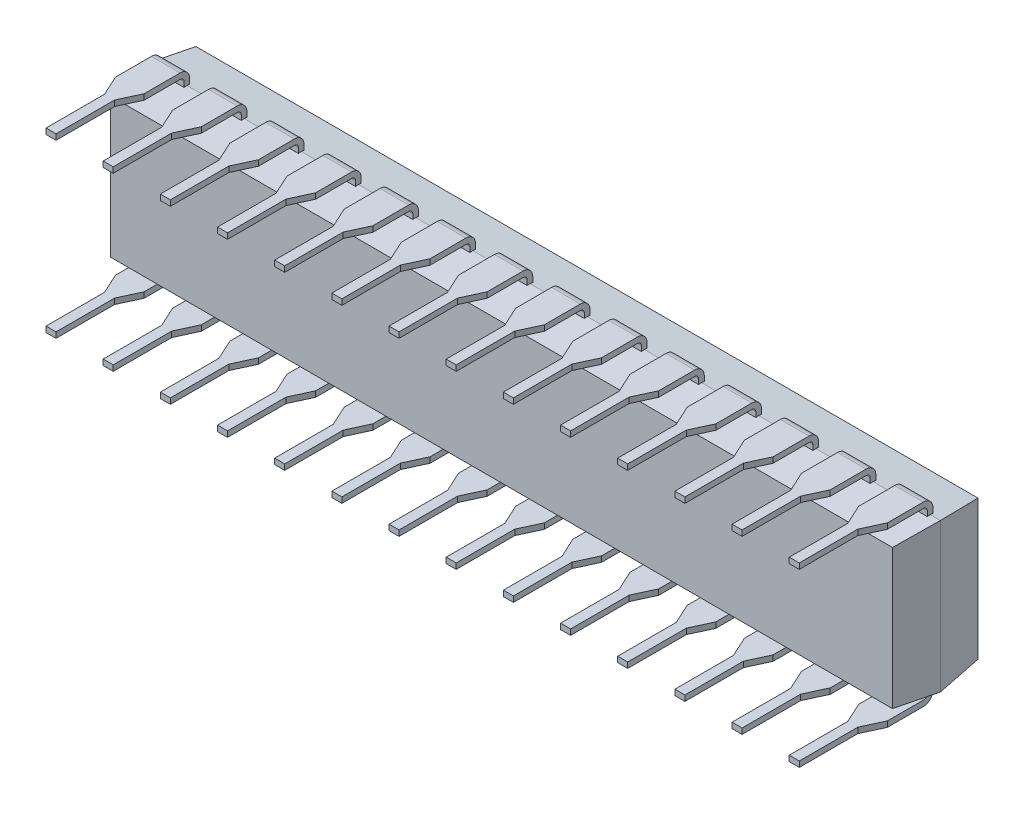
from build123d import *

# Parameters (mm, degrees)
RESSALTO_EXTRUS_O1_DEPTH        = 17.6
CORTE_EXTRUS_O2_DEPTH           = 3.55
ESBO_O8_R                       = 1
CORTE_EXTRUS_O5_DEPTH           = 0.5
ESBO_O6_W                       = 1.275
ESBO_O6_H                       = 0.25
RESSALTO_EXTRUS_O2_DEPTH        = 0.025
ESBO_O7_W                       = 1.275
ESBO_O7_H                       = 0.25
CORTE_EXTRUS_O6_START           = -0.25
CORTE_EXTRUS_O6_DEPTH           = 0.25
ESBO_O10_W                      = 0.445
ESBO_O10_H                      = 0.25
RESSALTO_EXTRUS_O3_DEPTH        = 2.6
PADR_O_LINEAR1_COUNT            = 14
PADR_O_LINEAR1_PITCH            = 2.54
PADR_O_LINEAR1_COPY_1_SKETCH_W  = 1.275
PADR_O_LINEAR1_COPY_1_SKETCH_H  = 0.25
PADR_O_LINEAR1_COPY_1_DEPTH     = 0.025
PADR_O_LINEAR1_COPY_2_SKETCH_W  = 1.275
PADR_O_LINEAR1_COPY_2_SKETCH_H  = 0.25
PADR_O_LINEAR1_COPY_2_DEPTH     = 0.025
PADR_O_LINEAR1_COPY_3_SKETCH_W  = 1.275
PADR_O_LINEAR1_COPY_3_SKETCH_H  = 0.25
PADR_O_LINEAR1_COPY_3_DEPTH     = 0.025
PADR_O_LINEAR1_COPY_4_SKETCH_W  = 1.275
PADR_O_LINEAR1_COPY_4_SKETCH_H  = 0.25
PADR_O_LINEAR1_COPY_4_DEPTH     = 0.025
PADR_O_LINEAR1_COPY_5_SKETCH_W  = 1.275
PADR_O_LINEAR1_COPY_5_SKETCH_H  = 0.25
PADR_O_LINEAR1_COPY_5_DEPTH     = 0.025
PADR_O_LINEAR1_COPY_6_SKETCH_W  = 1.275
PADR_O_LINEAR1_COPY_6_SKETCH_H  = 0.25
PADR_O_LINEAR1_COPY_6_DEPTH     = 0.025
PADR_O_LINEAR1_COPY_7_SKETCH_W  = 1.275
PADR_O_LINEAR1_COPY_7_SKETCH_H  = 0.25
PADR_O_LINEAR1_COPY_7_DEPTH     = 0.025
PADR_O_LINEAR1_COPY_8_SKETCH_W  = 1.275
PADR_O_LINEAR1_COPY_8_SKETCH_H  = 0.25
PADR_O_LINEAR1_COPY_8_DEPTH     = 0.025
PADR_O_LINEAR1_COPY_9_SKETCH_W  = 1.275
PADR_O_LINEAR1_COPY_9_SKETCH_H  = 0.25
PADR_O_LINEAR1_COPY_9_DEPTH     = 0.025
PADR_O_LINEAR1_COPY_10_SKETCH_W = 1.275
PADR_O_LINEAR1_COPY_10_SKETCH_H = 0.25
PADR_O_LINEAR1_COPY_10_DEPTH    = 0.025
PADR_O_LINEAR1_COPY_11_SKETCH_W = 1.275
PADR_O_LINEAR1_COPY_11_SKETCH_H = 0.25
PADR_O_LINEAR1_COPY_11_DEPTH    = 0.025
PADR_O_LINEAR1_COPY_12_SKETCH_W = 1.275
PADR_O_LINEAR1_COPY_12_SKETCH_H = 0.25
PADR_O_LINEAR1_COPY_12_DEPTH    = 0.025
PADR_O_LINEAR1_COPY_13_SKETCH_W = 1.275
PADR_O_LINEAR1_COPY_13_SKETCH_H = 0.25
PADR_O_LINEAR1_COPY_13_DEPTH    = 0.025
PADR_O_LINEAR1_COPY_14_SKETCH_W = 1.275
PADR_O_LINEAR1_COPY_14_SKETCH_H = 0.25
PADR_O_LINEAR1_COPY_15_SKETCH_W = 1.275
PADR_O_LINEAR1_COPY_15_SKETCH_H = 0.25
PADR_O_LINEAR1_COPY_16_SKETCH_W = 1.275
PADR_O_LINEAR1_COPY_16_SKETCH_H = 0.25
PADR_O_LINEAR1_COPY_17_SKETCH_W = 1.275
PADR_O_LINEAR1_COPY_17_SKETCH_H = 0.25
PADR_O_LINEAR1_COPY_18_SKETCH_W = 1.275
PADR_O_LINEAR1_COPY_18_SKETCH_H = 0.25
PADR_O_LINEAR1_COPY_19_SKETCH_W = 1.275
PADR_O_LINEAR1_COPY_19_SKETCH_H = 0.25
PADR_O_LINEAR1_COPY_20_SKETCH_W = 1.275
PADR_O_LINEAR1_COPY_20_SKETCH_H = 0.25
PADR_O_LINEAR1_COPY_21_SKETCH_W = 1.275
PADR_O_LINEAR1_COPY_21_SKETCH_H = 0.25
PADR_O_LINEAR1_COPY_22_SKETCH_W = 1.275
PADR_O_LINEAR1_COPY_22_SKETCH_H = 0.25
PADR_O_LINEAR1_COPY_23_SKETCH_W = 1.275
PADR_O_LINEAR1_COPY_23_SKETCH_H = 0.25
PADR_O_LINEAR1_COPY_24_SKETCH_W = 1.275
PADR_O_LINEAR1_COPY_24_SKETCH_H = 0.25
PADR_O_LINEAR1_COPY_25_SKETCH_W = 1.275
PADR_O_LINEAR1_COPY_25_SKETCH_H = 0.25
PADR_O_LINEAR1_COPY_26_SKETCH_W = 1.275
PADR_O_LINEAR1_COPY_26_SKETCH_H = 0.25
PADR_O_START                    = -0.25
PADR_O_LINEAR1_COPY_27_DEPTH    = 0.25
PADR_O_LINEAR1_COPY_28_DEPTH    = 0.25
PADR_O_LINEAR1_COPY_29_DEPTH    = 0.25
PADR_O_LINEAR1_COPY_30_DEPTH    = 0.25
PADR_O_LINEAR1_COPY_31_DEPTH    = 0.25
PADR_O_LINEAR1_COPY_32_DEPTH    = 0.25
PADR_O_LINEAR1_COPY_33_DEPTH    = 0.25
PADR_O_LINEAR1_COPY_34_DEPTH    = 0.25
PADR_O_LINEAR1_COPY_35_DEPTH    = 0.25
PADR_O_LINEAR1_COPY_36_DEPTH    = 0.25
PADR_O_LINEAR1_COPY_37_DEPTH    = 0.25
PADR_O_LINEAR1_COPY_38_DEPTH    = 0.25
PADR_O_LINEAR1_COPY_39_DEPTH    = 0.25
PADR_O_LINEAR1_COPY_40_SKETCH_W = 0.445
PADR_O_LINEAR1_COPY_40_SKETCH_H = 0.25
PADR_O_LINEAR1_COPY_40_DEPTH    = 2.6
PADR_O_LINEAR1_COPY_41_SKETCH_W = 0.445
PADR_O_LINEAR1_COPY_41_SKETCH_H = 0.25
PADR_O_LINEAR1_COPY_41_DEPTH    = 2.6
PADR_O_LINEAR1_COPY_42_SKETCH_W = 0.445
PADR_O_LINEAR1_COPY_42_SKETCH_H = 0.25
PADR_O_LINEAR1_COPY_42_DEPTH    = 2.6
PADR_O_LINEAR1_COPY_43_SKETCH_W = 0.445
PADR_O_LINEAR1_COPY_43_SKETCH_H = 0.25
PADR_O_LINEAR1_COPY_43_DEPTH    = 2.6
PADR_O_LINEAR1_COPY_44_SKETCH_W = 0.445
PADR_O_LINEAR1_COPY_44_SKETCH_H = 0.25
PADR_O_LINEAR1_COPY_44_DEPTH    = 2.6
PADR_O_LINEAR1_COPY_45_SKETCH_W = 0.445
PADR_O_LINEAR1_COPY_45_SKETCH_H = 0.25
PADR_O_LINEAR1_COPY_45_DEPTH    = 2.6
PADR_O_LINEAR1_COPY_46_SKETCH_W = 0.445
PADR_O_LINEAR1_COPY_46_SKETCH_H = 0.25
PADR_O_LINEAR1_COPY_46_DEPTH    = 2.6
PADR_O_LINEAR1_COPY_47_SKETCH_W = 0.445
PADR_O_LINEAR1_COPY_47_SKETCH_H = 0.25
PADR_O_LINEAR1_COPY_47_DEPTH    = 2.6
PADR_O_LINEAR1_COPY_48_SKETCH_W = 0.445
PADR_O_LINEAR1_COPY_48_SKETCH_H = 0.25
PADR_O_LINEAR1_COPY_48_DEPTH    = 2.6
PADR_O_LINEAR1_COPY_49_SKETCH_W = 0.445
PADR_O_LINEAR1_COPY_49_SKETCH_H = 0.25
PADR_O_LINEAR1_COPY_49_DEPTH    = 2.6
PADR_O_LINEAR1_COPY_50_SKETCH_W = 0.445
PADR_O_LINEAR1_COPY_50_SKETCH_H = 0.25
PADR_O_LINEAR1_COPY_50_DEPTH    = 2.6
PADR_O_LINEAR1_COPY_51_SKETCH_W = 0.445
PADR_O_LINEAR1_COPY_51_SKETCH_H = 0.25
PADR_O_LINEAR1_COPY_51_DEPTH    = 2.6
PADR_O_LINEAR1_COPY_52_SKETCH_W = 0.445
PADR_O_LINEAR1_COPY_52_SKETCH_H = 0.25
PADR_O_LINEAR1_COPY_52_DEPTH    = 2.6


with BuildPart() as part:
    # Esboço1 → Ressalto-extrusão1 (new, symmetric)
    with BuildSketch(Plane(origin=(0, 0, 0), x_dir=(0, 0, -1), z_dir=(1, 0, 0))):
        Polygon((0.9, 3.1), (0.9, -3.1), (2.8, -3.3), (4.7, -3.1), (4.7, 3.1), (2.8, 3.3), align=None)
    extrude(amount=RESSALTO_EXTRUS_O1_DEPTH, both=True)

    # Esboço3 → Corte-extrusão2 (cut, symmetric)
    with BuildSketch(Plane(origin=(0, 0, 0), x_dir=(1, 0, 0), z_dir=(0, 1, 0))):
        Polygon((-17.6, 2.8), (-17.369897634, 4.726835982), (-18.536348907, 4.726835982), (-18.536348907, 0.873164018), (-17.369897634, 0.873164018), align=None)
    corte_extrus_o2 = extrude(amount=CORTE_EXTRUS_O2_DEPTH, both=True, mode=Mode.SUBTRACT)

    # Espelhar1: Corte-extrusão2 across plane
    add(corte_extrus_o2.mirror(Plane(origin=(0, 0, 0), x_dir=(0, 0, 1), z_dir=(1, 0, 0))), mode=Mode.SUBTRACT)

    # Esboço8 → Corte-extrusão5 (cut)
    with BuildSketch(Plane(origin=(0, 0, -4.7), x_dir=(-1, 0, 0), z_dir=(0, 0, -1))):
        with Locations((17.373102382, 0)):
            Circle(ESBO_O8_R)
    extrude(amount=-CORTE_EXTRUS_O5_DEPTH, mode=Mode.SUBTRACT)

    # Esboço6 → Ressalto-extrusão2 (add, symmetric)
    with BuildSketch(Plane(origin=(0, 3.3, 0), x_dir=(1, 0, 0), z_dir=(0, 1, 0))):
        with Locations((-16.51, 2.8)):
            Rectangle(ESBO_O6_W, ESBO_O6_H)
    ressalto_extrus_o2 = extrude(amount=RESSALTO_EXTRUS_O2_DEPTH, both=True)

    # Varredura1: sweep along a curve in space
    with BuildLine() as varredura1_path:
        Line((-16.51, 3.325, -2.8), (-16.51, 3.51, -2.8))
        ThreePointArc((-16.51, 3.51, -2.8), (-16.51, 3.722132034, -2.712132034), (-16.51, 3.81, -2.5))
        Line((-16.51, 3.81, -2.5), (-16.51, 3.81, 0))
    # Esboço7 → Varredura1 (sweep)
    with BuildSketch(Plane(origin=(0, 3.325, 0), x_dir=(1, 0, 0), z_dir=(0, 1, 0))):
        with Locations((-16.51, 2.8)):
            Rectangle(ESBO_O7_W, ESBO_O7_H)
    varredura1 = sweep(path=varredura1_path.line)

    # Esboço9 → Corte-extrusão6 (cut)
    with BuildSketch(Plane(origin=(0, 3.935, 0), x_dir=(1, 0, 0), z_dir=(0, 1, 0)).offset(CORTE_EXTRUS_O6_START)):
        Polygon((-16.7325, 0), (-17.1475, 0.9), (-17.1475, -0.2), (-15.8725, -0.2), (-15.8725, 0.9), (-16.2875, 0), align=None)
    corte_extrus_o6 = extrude(amount=CORTE_EXTRUS_O6_DEPTH, mode=Mode.SUBTRACT)

    # Esboço10 → Ressalto-extrusão3 (add)
    with BuildSketch(Plane.XY):
        with Locations((-16.51, 3.81)):
            Rectangle(ESBO_O10_W, ESBO_O10_H)
    ressalto_extrus_o3 = extrude(amount=RESSALTO_EXTRUS_O3_DEPTH)

    # Espelhar2: Ressalto-extrusão2, Varredura1, Corte-extrusão6, Ressalto-extrusão3 across plane
    add(ressalto_extrus_o2.mirror(Plane.ZX))
    add(varredura1.mirror(Plane.ZX))
    add(corte_extrus_o6.mirror(Plane.ZX), mode=Mode.SUBTRACT)
    add(ressalto_extrus_o3.mirror(Plane.ZX))

    # Padrão linear1: Ressalto-extrusão2, Varredura1, Corte-extrusão6, Ressalto-extrusão3 ×14
    with Locations(*[(i * PADR_O_LINEAR1_PITCH, 0, 0) for i in range(1, PADR_O_LINEAR1_COUNT)]):
        add(ressalto_extrus_o2)
        add(varredura1)
        add(corte_extrus_o6, mode=Mode.SUBTRACT)
        add(ressalto_extrus_o3)

    # Padrão linear1 copy 1 sketch → Padrão linear1 copy 1 (add, symmetric)
    with BuildSketch(Plane(origin=(2.54, -3.3, 0), x_dir=(1, 0, 0), z_dir=(0, -1, 0))):
        with Locations((-16.51, -2.8)):
            Rectangle(PADR_O_LINEAR1_COPY_1_SKETCH_W, PADR_O_LINEAR1_COPY_1_SKETCH_H)
    extrude(amount=PADR_O_LINEAR1_COPY_1_DEPTH, both=True)

    # Padrão linear1 copy 2 sketch → Padrão linear1 copy 2 (add, symmetric)
    with BuildSketch(Plane(origin=(5.08, -3.3, 0), x_dir=(1, 0, 0), z_dir=(0, -1, 0))):
        with Locations((-16.51, -2.8)):
            Rectangle(PADR_O_LINEAR1_COPY_2_SKETCH_W, PADR_O_LINEAR1_COPY_2_SKETCH_H)
    extrude(amount=PADR_O_LINEAR1_COPY_2_DEPTH, both=True)

    # Padrão linear1 copy 3 sketch → Padrão linear1 copy 3 (add, symmetric)
    with BuildSketch(Plane(origin=(7.62, -3.3, 0), x_dir=(1, 0, 0), z_dir=(0, -1, 0))):
        with Locations((-16.51, -2.8)):
            Rectangle(PADR_O_LINEAR1_COPY_3_SKETCH_W, PADR_O_LINEAR1_COPY_3_SKETCH_H)
    extrude(amount=PADR_O_LINEAR1_COPY_3_DEPTH, both=True)

    # Padrão linear1 copy 4 sketch → Padrão linear1 copy 4 (add, symmetric)
    with BuildSketch(Plane(origin=(10.16, -3.3, 0), x_dir=(1, 0, 0), z_dir=(0, -1, 0))):
        with Locations((-16.51, -2.8)):
            Rectangle(PADR_O_LINEAR1_COPY_4_SKETCH_W, PADR_O_LINEAR1_COPY_4_SKETCH_H)
    extrude(amount=PADR_O_LINEAR1_COPY_4_DEPTH, both=True)

    # Padrão linear1 copy 5 sketch → Padrão linear1 copy 5 (add, symmetric)
    with BuildSketch(Plane(origin=(12.7, -3.3, 0), x_dir=(1, 0, 0), z_dir=(0, -1, 0))):
        with Locations((-16.51, -2.8)):
            Rectangle(PADR_O_LINEAR1_COPY_5_SKETCH_W, PADR_O_LINEAR1_COPY_5_SKETCH_H)
    extrude(amount=PADR_O_LINEAR1_COPY_5_DEPTH, both=True)

    # Padrão linear1 copy 6 sketch → Padrão linear1 copy 6 (add, symmetric)
    with BuildSketch(Plane(origin=(15.24, -3.3, 0), x_dir=(1, 0, 0), z_dir=(0, -1, 0))):
        with Locations((-16.51, -2.8)):
            Rectangle(PADR_O_LINEAR1_COPY_6_SKETCH_W, PADR_O_LINEAR1_COPY_6_SKETCH_H)
    extrude(amount=PADR_O_LINEAR1_COPY_6_DEPTH, both=True)

    # Padrão linear1 copy 7 sketch → Padrão linear1 copy 7 (add, symmetric)
    with BuildSketch(Plane(origin=(17.78, -3.3, 0), x_dir=(1, 0, 0), z_dir=(0, -1, 0))):
        with Locations((-16.51, -2.8)):
            Rectangle(PADR_O_LINEAR1_COPY_7_SKETCH_W, PADR_O_LINEAR1_COPY_7_SKETCH_H)
    extrude(amount=PADR_O_LINEAR1_COPY_7_DEPTH, both=True)

    # Padrão linear1 copy 8 sketch → Padrão linear1 copy 8 (add, symmetric)
    with BuildSketch(Plane(origin=(20.32, -3.3, 0), x_dir=(1, 0, 0), z_dir=(0, -1, 0))):
        with Locations((-16.51, -2.8)):
            Rectangle(PADR_O_LINEAR1_COPY_8_SKETCH_W, PADR_O_LINEAR1_COPY_8_SKETCH_H)
    extrude(amount=PADR_O_LINEAR1_COPY_8_DEPTH, both=True)

    # Padrão linear1 copy 9 sketch → Padrão linear1 copy 9 (add, symmetric)
    with BuildSketch(Plane(origin=(22.86, -3.3, 0), x_dir=(1, 0, 0), z_dir=(0, -1, 0))):
        with Locations((-16.51, -2.8)):
            Rectangle(PADR_O_LINEAR1_COPY_9_SKETCH_W, PADR_O_LINEAR1_COPY_9_SKETCH_H)
    extrude(amount=PADR_O_LINEAR1_COPY_9_DEPTH, both=True)

    # Padrão linear1 copy 10 sketch → Padrão linear1 copy 10 (add, symmetric)
    with BuildSketch(Plane(origin=(25.4, -3.3, 0), x_dir=(1, 0, 0), z_dir=(0, -1, 0))):
        with Locations((-16.51, -2.8)):
            Rectangle(PADR_O_LINEAR1_COPY_10_SKETCH_W, PADR_O_LINEAR1_COPY_10_SKETCH_H)
    extrude(amount=PADR_O_LINEAR1_COPY_10_DEPTH, both=True)

    # Padrão linear1 copy 11 sketch → Padrão linear1 copy 11 (add, symmetric)
    with BuildSketch(Plane(origin=(27.94, -3.3, 0), x_dir=(1, 0, 0), z_dir=(0, -1, 0))):
        with Locations((-16.51, -2.8)):
            Rectangle(PADR_O_LINEAR1_COPY_11_SKETCH_W, PADR_O_LINEAR1_COPY_11_SKETCH_H)
    extrude(amount=PADR_O_LINEAR1_COPY_11_DEPTH, both=True)

    # Padrão linear1 copy 12 sketch → Padrão linear1 copy 12 (add, symmetric)
    with BuildSketch(Plane(origin=(30.48, -3.3, 0), x_dir=(1, 0, 0), z_dir=(0, -1, 0))):
        with Locations((-16.51, -2.8)):
            Rectangle(PADR_O_LINEAR1_COPY_12_SKETCH_W, PADR_O_LINEAR1_COPY_12_SKETCH_H)
    extrude(amount=PADR_O_LINEAR1_COPY_12_DEPTH, both=True)

    # Padrão linear1 copy 13 sketch → Padrão linear1 copy 13 (add, symmetric)
    with BuildSketch(Plane(origin=(33.02, -3.3, 0), x_dir=(1, 0, 0), z_dir=(0, -1, 0))):
        with Locations((-16.51, -2.8)):
            Rectangle(PADR_O_LINEAR1_COPY_13_SKETCH_W, PADR_O_LINEAR1_COPY_13_SKETCH_H)
    extrude(amount=PADR_O_LINEAR1_COPY_13_DEPTH, both=True)

    # Padrão linear1 copy 14: sweep along a curve in space
    with BuildLine() as padr_o_linear1_copy_14_path:
        Line((-13.97, -3.325, -2.8), (-13.97, -3.51, -2.8))
        ThreePointArc((-13.97, -3.51, -2.8), (-13.97, -3.722132034, -2.712132034), (-13.97, -3.81, -2.5))
        Line((-13.97, -3.81, -2.5), (-13.97, -3.81, 0))
    # Padrão linear1 copy 14 sketch → Padrão linear1 copy 14 (sweep)
    with BuildSketch(Plane(origin=(2.54, -3.325, 0), x_dir=(1, 0, 0), z_dir=(0, -1, 0))):
        with Locations((-16.51, -2.8)):
            Rectangle(PADR_O_LINEAR1_COPY_14_SKETCH_W, PADR_O_LINEAR1_COPY_14_SKETCH_H)
    sweep(path=padr_o_linear1_copy_14_path.line)

    # Padrão linear1 copy 15: sweep along a curve in space
    with BuildLine() as padr_o_linear1_copy_15_path:
        Line((-11.43, -3.325, -2.8), (-11.43, -3.51, -2.8))
        ThreePointArc((-11.43, -3.51, -2.8), (-11.43, -3.722132034, -2.712132034), (-11.43, -3.81, -2.5))
        Line((-11.43, -3.81, -2.5), (-11.43, -3.81, 0))
    # Padrão linear1 copy 15 sketch → Padrão linear1 copy 15 (sweep)
    with BuildSketch(Plane(origin=(5.08, -3.325, 0), x_dir=(1, 0, 0), z_dir=(0, -1, 0))):
        with Locations((-16.51, -2.8)):
            Rectangle(PADR_O_LINEAR1_COPY_15_SKETCH_W, PADR_O_LINEAR1_COPY_15_SKETCH_H)
    sweep(path=padr_o_linear1_copy_15_path.line)

    # Padrão linear1 copy 16: sweep along a curve in space
    with BuildLine() as padr_o_linear1_copy_16_path:
        Line((-8.89, -3.325, -2.8), (-8.89, -3.51, -2.8))
        ThreePointArc((-8.89, -3.51, -2.8), (-8.89, -3.722132034, -2.712132034), (-8.89, -3.81, -2.5))
        Line((-8.89, -3.81, -2.5), (-8.89, -3.81, 0))
    # Padrão linear1 copy 16 sketch → Padrão linear1 copy 16 (sweep)
    with BuildSketch(Plane(origin=(7.62, -3.325, 0), x_dir=(1, 0, 0), z_dir=(0, -1, 0))):
        with Locations((-16.51, -2.8)):
            Rectangle(PADR_O_LINEAR1_COPY_16_SKETCH_W, PADR_O_LINEAR1_COPY_16_SKETCH_H)
    sweep(path=padr_o_linear1_copy_16_path.line)

    # Padrão linear1 copy 17: sweep along a curve in space
    with BuildLine() as padr_o_linear1_copy_17_path:
        Line((-6.35, -3.325, -2.8), (-6.35, -3.51, -2.8))
        ThreePointArc((-6.35, -3.51, -2.8), (-6.35, -3.722132034, -2.712132034), (-6.35, -3.81, -2.5))
        Line((-6.35, -3.81, -2.5), (-6.35, -3.81, 0))
    # Padrão linear1 copy 17 sketch → Padrão linear1 copy 17 (sweep)
    with BuildSketch(Plane(origin=(10.16, -3.325, 0), x_dir=(1, 0, 0), z_dir=(0, -1, 0))):
        with Locations((-16.51, -2.8)):
            Rectangle(PADR_O_LINEAR1_COPY_17_SKETCH_W, PADR_O_LINEAR1_COPY_17_SKETCH_H)
    sweep(path=padr_o_linear1_copy_17_path.line)

    # Padrão linear1 copy 18: sweep along a curve in space
    with BuildLine() as padr_o_linear1_copy_18_path:
        Line((-3.81, -3.325, -2.8), (-3.81, -3.51, -2.8))
        ThreePointArc((-3.81, -3.51, -2.8), (-3.81, -3.722132034, -2.712132034), (-3.81, -3.81, -2.5))
        Line((-3.81, -3.81, -2.5), (-3.81, -3.81, 0))
    # Padrão linear1 copy 18 sketch → Padrão linear1 copy 18 (sweep)
    with BuildSketch(Plane(origin=(12.7, -3.325, 0), x_dir=(1, 0, 0), z_dir=(0, -1, 0))):
        with Locations((-16.51, -2.8)):
            Rectangle(PADR_O_LINEAR1_COPY_18_SKETCH_W, PADR_O_LINEAR1_COPY_18_SKETCH_H)
    sweep(path=padr_o_linear1_copy_18_path.line)

    # Padrão linear1 copy 19: sweep along a curve in space
    with BuildLine() as padr_o_linear1_copy_19_path:
        Line((-1.27, -3.325, -2.8), (-1.27, -3.51, -2.8))
        ThreePointArc((-1.27, -3.51, -2.8), (-1.27, -3.722132034, -2.712132034), (-1.27, -3.81, -2.5))
        Line((-1.27, -3.81, -2.5), (-1.27, -3.81, 0))
    # Padrão linear1 copy 19 sketch → Padrão linear1 copy 19 (sweep)
    with BuildSketch(Plane(origin=(15.24, -3.325, 0), x_dir=(1, 0, 0), z_dir=(0, -1, 0))):
        with Locations((-16.51, -2.8)):
            Rectangle(PADR_O_LINEAR1_COPY_19_SKETCH_W, PADR_O_LINEAR1_COPY_19_SKETCH_H)
    sweep(path=padr_o_linear1_copy_19_path.line)

    # Padrão linear1 copy 20: sweep along a curve in space
    with BuildLine() as padr_o_linear1_copy_20_path:
        Line((1.27, -3.325, -2.8), (1.27, -3.51, -2.8))
        ThreePointArc((1.27, -3.51, -2.8), (1.27, -3.722132034, -2.712132034), (1.27, -3.81, -2.5))
        Line((1.27, -3.81, -2.5), (1.27, -3.81, 0))
    # Padrão linear1 copy 20 sketch → Padrão linear1 copy 20 (sweep)
    with BuildSketch(Plane(origin=(17.78, -3.325, 0), x_dir=(1, 0, 0), z_dir=(0, -1, 0))):
        with Locations((-16.51, -2.8)):
            Rectangle(PADR_O_LINEAR1_COPY_20_SKETCH_W, PADR_O_LINEAR1_COPY_20_SKETCH_H)
    sweep(path=padr_o_linear1_copy_20_path.line)

    # Padrão linear1 copy 21: sweep along a curve in space
    with BuildLine() as padr_o_linear1_copy_21_path:
        Line((3.81, -3.325, -2.8), (3.81, -3.51, -2.8))
        ThreePointArc((3.81, -3.51, -2.8), (3.81, -3.722132034, -2.712132034), (3.81, -3.81, -2.5))
        Line((3.81, -3.81, -2.5), (3.81, -3.81, 0))
    # Padrão linear1 copy 21 sketch → Padrão linear1 copy 21 (sweep)
    with BuildSketch(Plane(origin=(20.32, -3.325, 0), x_dir=(1, 0, 0), z_dir=(0, -1, 0))):
        with Locations((-16.51, -2.8)):
            Rectangle(PADR_O_LINEAR1_COPY_21_SKETCH_W, PADR_O_LINEAR1_COPY_21_SKETCH_H)
    sweep(path=padr_o_linear1_copy_21_path.line)

    # Padrão linear1 copy 22: sweep along a curve in space
    with BuildLine() as padr_o_linear1_copy_22_path:
        Line((6.35, -3.325, -2.8), (6.35, -3.51, -2.8))
        ThreePointArc((6.35, -3.51, -2.8), (6.35, -3.722132034, -2.712132034), (6.35, -3.81, -2.5))
        Line((6.35, -3.81, -2.5), (6.35, -3.81, 0))
    # Padrão linear1 copy 22 sketch → Padrão linear1 copy 22 (sweep)
    with BuildSketch(Plane(origin=(22.86, -3.325, 0), x_dir=(1, 0, 0), z_dir=(0, -1, 0))):
        with Locations((-16.51, -2.8)):
            Rectangle(PADR_O_LINEAR1_COPY_22_SKETCH_W, PADR_O_LINEAR1_COPY_22_SKETCH_H)
    sweep(path=padr_o_linear1_copy_22_path.line)

    # Padrão linear1 copy 23: sweep along a curve in space
    with BuildLine() as padr_o_linear1_copy_23_path:
        Line((8.89, -3.325, -2.8), (8.89, -3.51, -2.8))
        ThreePointArc((8.89, -3.51, -2.8), (8.89, -3.722132034, -2.712132034), (8.89, -3.81, -2.5))
        Line((8.89, -3.81, -2.5), (8.89, -3.81, 0))
    # Padrão linear1 copy 23 sketch → Padrão linear1 copy 23 (sweep)
    with BuildSketch(Plane(origin=(25.4, -3.325, 0), x_dir=(1, 0, 0), z_dir=(0, -1, 0))):
        with Locations((-16.51, -2.8)):
            Rectangle(PADR_O_LINEAR1_COPY_23_SKETCH_W, PADR_O_LINEAR1_COPY_23_SKETCH_H)
    sweep(path=padr_o_linear1_copy_23_path.line)

    # Padrão linear1 copy 24: sweep along a curve in space
    with BuildLine() as padr_o_linear1_copy_24_path:
        Line((11.43, -3.325, -2.8), (11.43, -3.51, -2.8))
        ThreePointArc((11.43, -3.51, -2.8), (11.43, -3.722132034, -2.712132034), (11.43, -3.81, -2.5))
        Line((11.43, -3.81, -2.5), (11.43, -3.81, 0))
    # Padrão linear1 copy 24 sketch → Padrão linear1 copy 24 (sweep)
    with BuildSketch(Plane(origin=(27.94, -3.325, 0), x_dir=(1, 0, 0), z_dir=(0, -1, 0))):
        with Locations((-16.51, -2.8)):
            Rectangle(PADR_O_LINEAR1_COPY_24_SKETCH_W, PADR_O_LINEAR1_COPY_24_SKETCH_H)
    sweep(path=padr_o_linear1_copy_24_path.line)

    # Padrão linear1 copy 25: sweep along a curve in space
    with BuildLine() as padr_o_linear1_copy_25_path:
        Line((13.97, -3.325, -2.8), (13.97, -3.51, -2.8))
        ThreePointArc((13.97, -3.51, -2.8), (13.97, -3.722132034, -2.712132034), (13.97, -3.81, -2.5))
        Line((13.97, -3.81, -2.5), (13.97, -3.81, 0))
    # Padrão linear1 copy 25 sketch → Padrão linear1 copy 25 (sweep)
    with BuildSketch(Plane(origin=(30.48, -3.325, 0), x_dir=(1, 0, 0), z_dir=(0, -1, 0))):
        with Locations((-16.51, -2.8)):
            Rectangle(PADR_O_LINEAR1_COPY_25_SKETCH_W, PADR_O_LINEAR1_COPY_25_SKETCH_H)
    sweep(path=padr_o_linear1_copy_25_path.line)

    # Padrão linear1 copy 26: sweep along a curve in space
    with BuildLine() as padr_o_linear1_copy_26_path:
        Line((16.51, -3.325, -2.8), (16.51, -3.51, -2.8))
        ThreePointArc((16.51, -3.51, -2.8), (16.51, -3.722132034, -2.712132034), (16.51, -3.81, -2.5))
        Line((16.51, -3.81, -2.5), (16.51, -3.81, 0))
    # Padrão linear1 copy 26 sketch → Padrão linear1 copy 26 (sweep)
    with BuildSketch(Plane(origin=(33.02, -3.325, 0), x_dir=(1, 0, 0), z_dir=(0, -1, 0))):
        with Locations((-16.51, -2.8)):
            Rectangle(PADR_O_LINEAR1_COPY_26_SKETCH_W, PADR_O_LINEAR1_COPY_26_SKETCH_H)
    sweep(path=padr_o_linear1_copy_26_path.line)

    # Padrão linear1 copy 27 sketch → Padrão linear1 copy 27 (cut)
    with BuildSketch(Plane(origin=(2.54, -3.935, 0), x_dir=(1, 0, 0), z_dir=(0, -1, 0)).offset(PADR_O_START)):
        Polygon((-16.7325, 0), (-17.1475, -0.9), (-17.1475, 0.2), (-15.8725, 0.2), (-15.8725, -0.9), (-16.2875, 0), align=None)
    extrude(amount=PADR_O_LINEAR1_COPY_27_DEPTH, mode=Mode.SUBTRACT)

    # Padrão linear1 copy 28 sketch → Padrão linear1 copy 28 (cut)
    with BuildSketch(Plane(origin=(5.08, -3.935, 0), x_dir=(1, 0, 0), z_dir=(0, -1, 0)).offset(PADR_O_START)):
        Polygon((-16.7325, 0), (-17.1475, -0.9), (-17.1475, 0.2), (-15.8725, 0.2), (-15.8725, -0.9), (-16.2875, 0), align=None)
    extrude(amount=PADR_O_LINEAR1_COPY_28_DEPTH, mode=Mode.SUBTRACT)

    # Padrão linear1 copy 29 sketch → Padrão linear1 copy 29 (cut)
    with BuildSketch(Plane(origin=(7.62, -3.935, 0), x_dir=(1, 0, 0), z_dir=(0, -1, 0)).offset(PADR_O_START)):
        Polygon((-16.7325, 0), (-17.1475, -0.9), (-17.1475, 0.2), (-15.8725, 0.2), (-15.8725, -0.9), (-16.2875, 0), align=None)
    extrude(amount=PADR_O_LINEAR1_COPY_29_DEPTH, mode=Mode.SUBTRACT)

    # Padrão linear1 copy 30 sketch → Padrão linear1 copy 30 (cut)
    with BuildSketch(Plane(origin=(10.16, -3.935, 0), x_dir=(1, 0, 0), z_dir=(0, -1, 0)).offset(PADR_O_START)):
        Polygon((-16.7325, 0), (-17.1475, -0.9), (-17.1475, 0.2), (-15.8725, 0.2), (-15.8725, -0.9), (-16.2875, 0), align=None)
    extrude(amount=PADR_O_LINEAR1_COPY_30_DEPTH, mode=Mode.SUBTRACT)

    # Padrão linear1 copy 31 sketch → Padrão linear1 copy 31 (cut)
    with BuildSketch(Plane(origin=(12.7, -3.935, 0), x_dir=(1, 0, 0), z_dir=(0, -1, 0)).offset(PADR_O_START)):
        Polygon((-16.7325, 0), (-17.1475, -0.9), (-17.1475, 0.2), (-15.8725, 0.2), (-15.8725, -0.9), (-16.2875, 0), align=None)
    extrude(amount=PADR_O_LINEAR1_COPY_31_DEPTH, mode=Mode.SUBTRACT)

    # Padrão linear1 copy 32 sketch → Padrão linear1 copy 32 (cut)
    with BuildSketch(Plane(origin=(15.24, -3.935, 0), x_dir=(1, 0, 0), z_dir=(0, -1, 0)).offset(PADR_O_START)):
        Polygon((-16.7325, 0), (-17.1475, -0.9), (-17.1475, 0.2), (-15.8725, 0.2), (-15.8725, -0.9), (-16.2875, 0), align=None)
    extrude(amount=PADR_O_LINEAR1_COPY_32_DEPTH, mode=Mode.SUBTRACT)

    # Padrão linear1 copy 33 sketch → Padrão linear1 copy 33 (cut)
    with BuildSketch(Plane(origin=(17.78, -3.935, 0), x_dir=(1, 0, 0), z_dir=(0, -1, 0)).offset(PADR_O_START)):
        Polygon((-16.7325, 0), (-17.1475, -0.9), (-17.1475, 0.2), (-15.8725, 0.2), (-15.8725, -0.9), (-16.2875, 0), align=None)
    extrude(amount=PADR_O_LINEAR1_COPY_33_DEPTH, mode=Mode.SUBTRACT)

    # Padrão linear1 copy 34 sketch → Padrão linear1 copy 34 (cut)
    with BuildSketch(Plane(origin=(20.32, -3.935, 0), x_dir=(1, 0, 0), z_dir=(0, -1, 0)).offset(PADR_O_START)):
        Polygon((-16.7325, 0), (-17.1475, -0.9), (-17.1475, 0.2), (-15.8725, 0.2), (-15.8725, -0.9), (-16.2875, 0), align=None)
    extrude(amount=PADR_O_LINEAR1_COPY_34_DEPTH, mode=Mode.SUBTRACT)

    # Padrão linear1 copy 35 sketch → Padrão linear1 copy 35 (cut)
    with BuildSketch(Plane(origin=(22.86, -3.935, 0), x_dir=(1, 0, 0), z_dir=(0, -1, 0)).offset(PADR_O_START)):
        Polygon((-16.7325, 0), (-17.1475, -0.9), (-17.1475, 0.2), (-15.8725, 0.2), (-15.8725, -0.9), (-16.2875, 0), align=None)
    extrude(amount=PADR_O_LINEAR1_COPY_35_DEPTH, mode=Mode.SUBTRACT)

    # Padrão linear1 copy 36 sketch → Padrão linear1 copy 36 (cut)
    with BuildSketch(Plane(origin=(25.4, -3.935, 0), x_dir=(1, 0, 0), z_dir=(0, -1, 0)).offset(PADR_O_START)):
        Polygon((-16.7325, 0), (-17.1475, -0.9), (-17.1475, 0.2), (-15.8725, 0.2), (-15.8725, -0.9), (-16.2875, 0), align=None)
    extrude(amount=PADR_O_LINEAR1_COPY_36_DEPTH, mode=Mode.SUBTRACT)

    # Padrão linear1 copy 37 sketch → Padrão linear1 copy 37 (cut)
    with BuildSketch(Plane(origin=(27.94, -3.935, 0), x_dir=(1, 0, 0), z_dir=(0, -1, 0)).offset(PADR_O_START)):
        Polygon((-16.7325, 0), (-17.1475, -0.9), (-17.1475, 0.2), (-15.8725, 0.2), (-15.8725, -0.9), (-16.2875, 0), align=None)
    extrude(amount=PADR_O_LINEAR1_COPY_37_DEPTH, mode=Mode.SUBTRACT)

    # Padrão linear1 copy 38 sketch → Padrão linear1 copy 38 (cut)
    with BuildSketch(Plane(origin=(30.48, -3.935, 0), x_dir=(1, 0, 0), z_dir=(0, -1, 0)).offset(PADR_O_START)):
        Polygon((-16.7325, 0), (-17.1475, -0.9), (-17.1475, 0.2), (-15.8725, 0.2), (-15.8725, -0.9), (-16.2875, 0), align=None)
    extrude(amount=PADR_O_LINEAR1_COPY_38_DEPTH, mode=Mode.SUBTRACT)

    # Padrão linear1 copy 39 sketch → Padrão linear1 copy 39 (cut)
    with BuildSketch(Plane(origin=(33.02, -3.935, 0), x_dir=(1, 0, 0), z_dir=(0, -1, 0)).offset(PADR_O_START)):
        Polygon((-16.7325, 0), (-17.1475, -0.9), (-17.1475, 0.2), (-15.8725, 0.2), (-15.8725, -0.9), (-16.2875, 0), align=None)
    extrude(amount=PADR_O_LINEAR1_COPY_39_DEPTH, mode=Mode.SUBTRACT)

    # Padrão linear1 copy 40 sketch → Padrão linear1 copy 40 (add)
    with BuildSketch(Plane(origin=(2.54, 0, 0), x_dir=(1, 0, 0), z_dir=(0, 0, 1))):
        with Locations((-16.51, -3.81)):
            Rectangle(PADR_O_LINEAR1_COPY_40_SKETCH_W, PADR_O_LINEAR1_COPY_40_SKETCH_H)
    extrude(amount=PADR_O_LINEAR1_COPY_40_DEPTH)

    # Padrão linear1 copy 41 sketch → Padrão linear1 copy 41 (add)
    with BuildSketch(Plane(origin=(5.08, 0, 0), x_dir=(1, 0, 0), z_dir=(0, 0, 1))):
        with Locations((-16.51, -3.81)):
            Rectangle(PADR_O_LINEAR1_COPY_41_SKETCH_W, PADR_O_LINEAR1_COPY_41_SKETCH_H)
    extrude(amount=PADR_O_LINEAR1_COPY_41_DEPTH)

    # Padrão linear1 copy 42 sketch → Padrão linear1 copy 42 (add)
    with BuildSketch(Plane(origin=(7.62, 0, 0), x_dir=(1, 0, 0), z_dir=(0, 0, 1))):
        with Locations((-16.51, -3.81)):
            Rectangle(PADR_O_LINEAR1_COPY_42_SKETCH_W, PADR_O_LINEAR1_COPY_42_SKETCH_H)
    extrude(amount=PADR_O_LINEAR1_COPY_42_DEPTH)

    # Padrão linear1 copy 43 sketch → Padrão linear1 copy 43 (add)
    with BuildSketch(Plane(origin=(10.16, 0, 0), x_dir=(1, 0, 0), z_dir=(0, 0, 1))):
        with Locations((-16.51, -3.81)):
            Rectangle(PADR_O_LINEAR1_COPY_43_SKETCH_W, PADR_O_LINEAR1_COPY_43_SKETCH_H)
    extrude(amount=PADR_O_LINEAR1_COPY_43_DEPTH)

    # Padrão linear1 copy 44 sketch → Padrão linear1 copy 44 (add)
    with BuildSketch(Plane(origin=(12.7, 0, 0), x_dir=(1, 0, 0), z_dir=(0, 0, 1))):
        with Locations((-16.51, -3.81)):
            Rectangle(PADR_O_LINEAR1_COPY_44_SKETCH_W, PADR_O_LINEAR1_COPY_44_SKETCH_H)
    extrude(amount=PADR_O_LINEAR1_COPY_44_DEPTH)

    # Padrão linear1 copy 45 sketch → Padrão linear1 copy 45 (add)
    with BuildSketch(Plane(origin=(15.24, 0, 0), x_dir=(1, 0, 0), z_dir=(0, 0, 1))):
        with Locations((-16.51, -3.81)):
            Rectangle(PADR_O_LINEAR1_COPY_45_SKETCH_W, PADR_O_LINEAR1_COPY_45_SKETCH_H)
    extrude(amount=PADR_O_LINEAR1_COPY_45_DEPTH)

    # Padrão linear1 copy 46 sketch → Padrão linear1 copy 46 (add)
    with BuildSketch(Plane(origin=(17.78, 0, 0), x_dir=(1, 0, 0), z_dir=(0, 0, 1))):
        with Locations((-16.51, -3.81)):
            Rectangle(PADR_O_LINEAR1_COPY_46_SKETCH_W, PADR_O_LINEAR1_COPY_46_SKETCH_H)
    extrude(amount=PADR_O_LINEAR1_COPY_46_DEPTH)

    # Padrão linear1 copy 47 sketch → Padrão linear1 copy 47 (add)
    with BuildSketch(Plane(origin=(20.32, 0, 0), x_dir=(1, 0, 0), z_dir=(0, 0, 1))):
        with Locations((-16.51, -3.81)):
            Rectangle(PADR_O_LINEAR1_COPY_47_SKETCH_W, PADR_O_LINEAR1_COPY_47_SKETCH_H)
    extrude(amount=PADR_O_LINEAR1_COPY_47_DEPTH)

    # Padrão linear1 copy 48 sketch → Padrão linear1 copy 48 (add)
    with BuildSketch(Plane(origin=(22.86, 0, 0), x_dir=(1, 0, 0), z_dir=(0, 0, 1))):
        with Locations((-16.51, -3.81)):
            Rectangle(PADR_O_LINEAR1_COPY_48_SKETCH_W, PADR_O_LINEAR1_COPY_48_SKETCH_H)
    extrude(amount=PADR_O_LINEAR1_COPY_48_DEPTH)

    # Padrão linear1 copy 49 sketch → Padrão linear1 copy 49 (add)
    with BuildSketch(Plane(origin=(25.4, 0, 0), x_dir=(1, 0, 0), z_dir=(0, 0, 1))):
        with Locations((-16.51, -3.81)):
            Rectangle(PADR_O_LINEAR1_COPY_49_SKETCH_W, PADR_O_LINEAR1_COPY_49_SKETCH_H)
    extrude(amount=PADR_O_LINEAR1_COPY_49_DEPTH)

    # Padrão linear1 copy 50 sketch → Padrão linear1 copy 50 (add)
    with BuildSketch(Plane(origin=(27.94, 0, 0), x_dir=(1, 0, 0), z_dir=(0, 0, 1))):
        with Locations((-16.51, -3.81)):
            Rectangle(PADR_O_LINEAR1_COPY_50_SKETCH_W, PADR_O_LINEAR1_COPY_50_SKETCH_H)
    extrude(amount=PADR_O_LINEAR1_COPY_50_DEPTH)

    # Padrão linear1 copy 51 sketch → Padrão linear1 copy 51 (add)
    with BuildSketch(Plane(origin=(30.48, 0, 0), x_dir=(1, 0, 0), z_dir=(0, 0, 1))):
        with Locations((-16.51, -3.81)):
            Rectangle(PADR_O_LINEAR1_COPY_51_SKETCH_W, PADR_O_LINEAR1_COPY_51_SKETCH_H)
    extrude(amount=PADR_O_LINEAR1_COPY_51_DEPTH)

    # Padrão linear1 copy 52 sketch → Padrão linear1 copy 52 (add)
    with BuildSketch(Plane(origin=(33.02, 0, 0), x_dir=(1, 0, 0), z_dir=(0, 0, 1))):
        with Locations((-16.51, -3.81)):
            Rectangle(PADR_O_LINEAR1_COPY_52_SKETCH_W, PADR_O_LINEAR1_COPY_52_SKETCH_H)
    extrude(amount=PADR_O_LINEAR1_COPY_52_DEPTH)


solid = part.part
